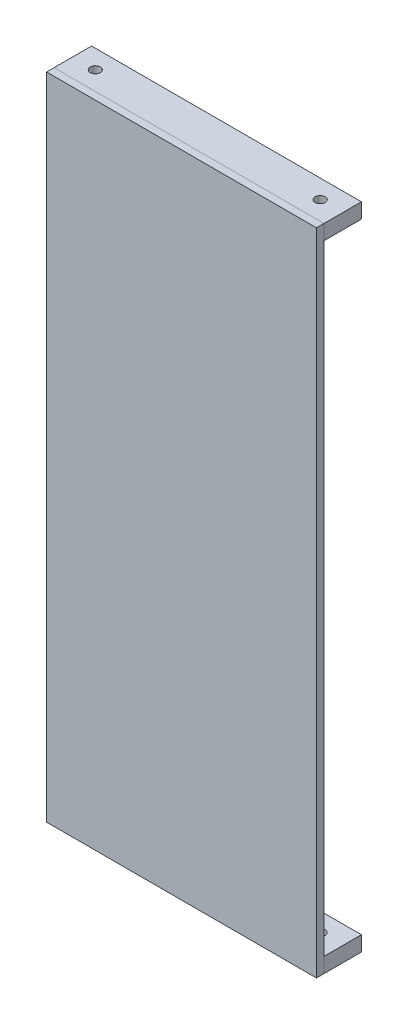
from build123d import *

# Parameters (mm, degrees)
BOSS_EXTRUDE1_DEPTH      = 1.5
BOSS_EXTRUDE1_DEPTH_BACK = 1.5
SKETCH1_W                = 108
SKETCH1_H                = 260
SKETCH2_W                = 108
SKETCH2_H                = 15
SKETCH2_R                = 2
BOSS_EXTRUDE2_DEPTH      = 6
LPATTERN1_COUNT          = 2
LPATTERN1_PITCH          = 254


with BuildPart() as part:
    # Sketch1 → Boss-Extrude1 (new, two sides: drawn at the far end of the back side and taken through both)
    with BuildSketch(Plane.XY.offset(-BOSS_EXTRUDE1_DEPTH_BACK)):
        Rectangle(SKETCH1_W, SKETCH1_H)
    extrude(amount=BOSS_EXTRUDE1_DEPTH + BOSS_EXTRUDE1_DEPTH_BACK)


with BuildPart() as body_2:
    # Sketch2 → Boss-Extrude2 (new body)
    with BuildSketch(Plane(origin=(0, 130, 0), x_dir=(1, 0, 0), z_dir=(0, 1, 0))):
        with Locations((0, 9)):
            Rectangle(SKETCH2_W, SKETCH2_H)
        with Locations((45, 9)):
            Circle(SKETCH2_R, mode=Mode.SUBTRACT)
        with Locations((-45, 9)):
            Circle(SKETCH2_R, mode=Mode.SUBTRACT)
    boss_extrude2 = extrude(amount=-BOSS_EXTRUDE2_DEPTH)


with BuildPart() as lpattern1_1:
    # LPattern1: Boss-Extrude2 ×2
    with Locations(*[(0, -i * LPATTERN1_PITCH, 0) for i in range(1, LPATTERN1_COUNT)]):
        add(boss_extrude2)


solid = Compound([part.part, body_2.part, lpattern1_1.part])
